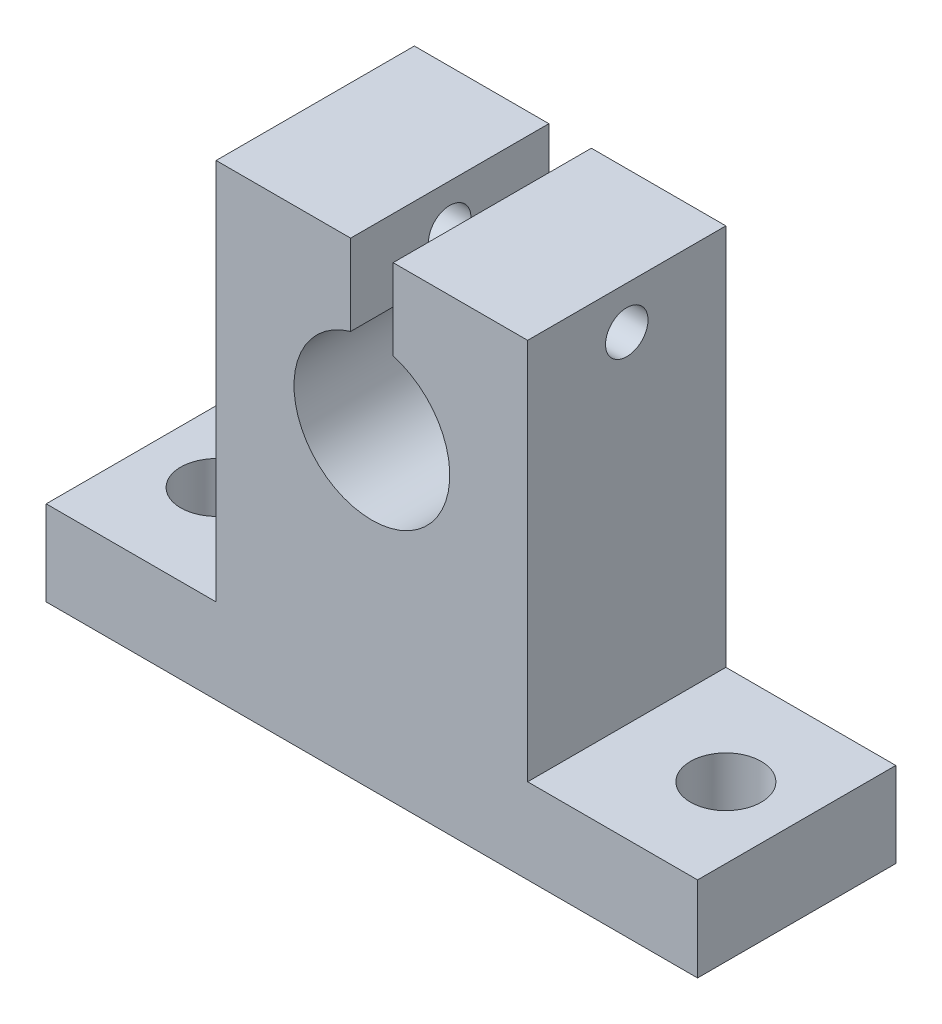
from build123d import *

# Parameters (mm, degrees)
SKETCH_1_W          = 12
SKETCH_1_H          = 6
EXTRUDE_1_DEPTH     = 14
SKETCH_2_R          = 2.5
CUT_EXTRUDE_1_DEPTH = 14
SKETCH_4_R          = 1.5
CUT_EXTRUDE_2_DEPTH = 28
SKETCH_5_R          = 5.5
CUT_EXTRUDE_3_DEPTH = 22


with BuildPart() as part:
    # 草图1 → 凸台-拉伸1 (new body)
    with BuildSketch(Plane.XY):
        with BuildLine():
            Line((-2.226515598, 16.75), (-11.726515598, 16.75))
            Line((-11.726515598, 16.75), (-11.726515598, -10.25))
            Line((-11.726515598, -10.25), (-11.726515598, -16.25))
            Line((-11.726515598, -16.25), (10.273484402, -16.25))
            Line((10.273484402, -16.25), (10.273484402, -10.25))
            Line((10.273484402, -10.25), (10.273484402, 16.75))
            Line((10.273484402, 16.75), (0.773484402, 16.75))
            Line((0.773484402, 16.75), (0.773484402, 9.992640687))
            ThreePointArc((0.773484402, 9.992640687), (2.947719016, 8.348076211), (3.773484402, 5.75))
            ThreePointArc((3.773484402, 5.75), (-3.324591809, 2.075765386), (-2.226515598, 9.992640687))
            Line((-2.226515598, 9.992640687), (-2.226515598, 16.75))
        make_face()
        with Locations((16.273484402, -13.25)):
            Rectangle(SKETCH_1_W, SKETCH_1_H)
        with Locations((-17.726515598, -13.25)):
            Rectangle(SKETCH_1_W, SKETCH_1_H)
    extrude(amount=EXTRUDE_1_DEPTH)

    # 草图2 → 切除-拉伸1 (cut)
    with BuildSketch(Plane(origin=(0, -16.25, 0), x_dir=(-1, 0, 0), z_dir=(0, -1, 0))):
        with Locations(Location((18.726515598, -7, 0), (0, 0, 180))):
            Circle(SKETCH_2_R)
        with Locations(Location((-17.273484402, -7, 0), (0, 0, 270))):
            Circle(SKETCH_2_R)
    extrude(amount=-CUT_EXTRUDE_1_DEPTH, mode=Mode.SUBTRACT)

    # 草图4 → 切除-拉伸2 (cut)
    with BuildSketch(Plane.ZY.offset(11.726515598)):
        with Locations(Location((7, 13.75, 0), (0, 0, 90))):
            Circle(SKETCH_4_R)
    extrude(amount=-CUT_EXTRUDE_2_DEPTH, mode=Mode.SUBTRACT)

    # 草图5 → 切除-拉伸3 (cut)
    with BuildSketch(Plane.XY.offset(14)):
        with Locations((-0.726515598, 5.75)):
            Circle(SKETCH_5_R)
    extrude(amount=-CUT_EXTRUDE_3_DEPTH, mode=Mode.SUBTRACT)


solid = part.part
